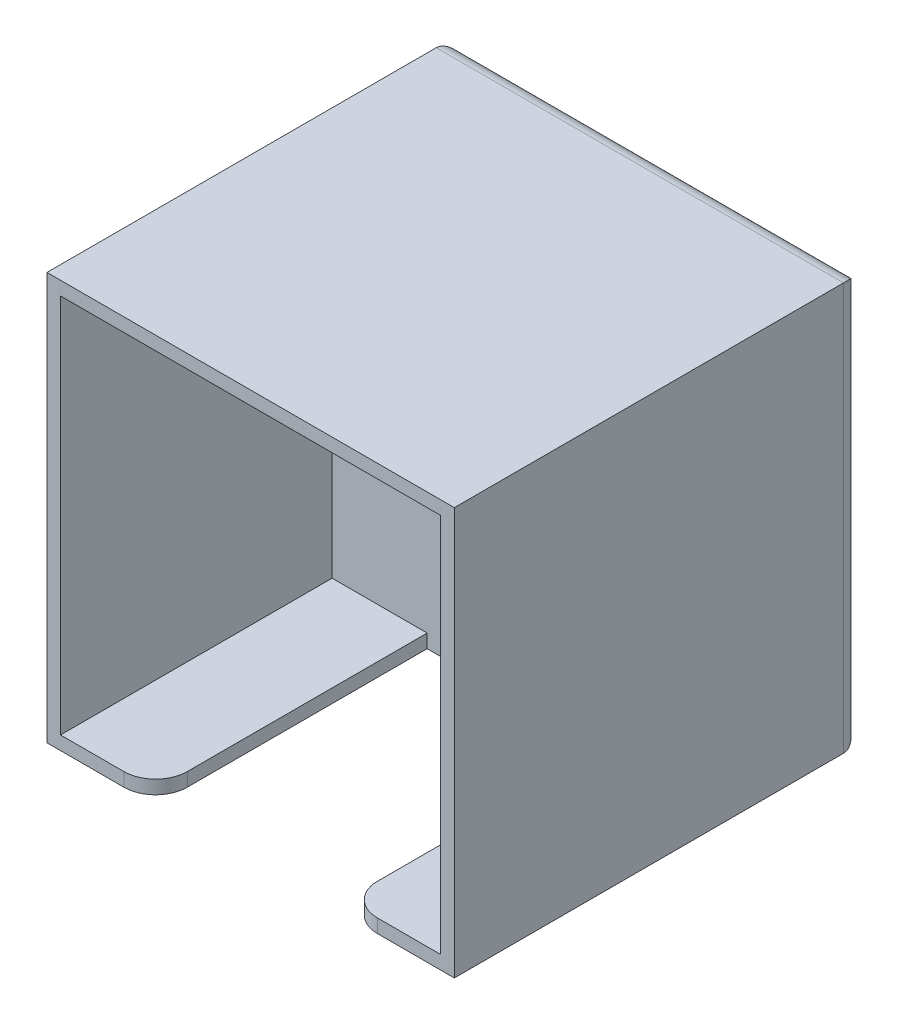
from build123d import *

# Parameters (mm, degrees)
SKETCH_2_W          = 45
SKETCH_2_H          = 45
EXTRUDE_1_DEPTH     = 45
SKETCH_3_W          = 42
SKETCH_3_H          = 42
CUT_EXTRUDE_1_DEPTH = 30
CUT_EXTRUDE_2_REACH = 69.5
SKETCH_4_W          = 21
SKETCH_4_H          = 30
FILLET_2_R          = 3.5
FILLET_3_R          = 2


with BuildPart() as part:
    # 草图2 → 凸台-拉伸1 (new body)
    with BuildSketch(Plane.XY):
        Rectangle(SKETCH_2_W, SKETCH_2_H)
    extrude(amount=EXTRUDE_1_DEPTH)

    # 草图3 → 切除-拉伸1 (cut)
    with BuildSketch(Plane.XY.offset(45)):
        Rectangle(SKETCH_3_W, SKETCH_3_H)
    extrude(amount=-CUT_EXTRUDE_1_DEPTH, mode=Mode.SUBTRACT)

    # 草图4 → 切除-拉伸2 (cut, up to next)
    with BuildSketch(Plane.XZ.offset(22.5), mode=Mode.PRIVATE) as cut_extrude_2_sk1:
        with Locations((0, 30)):
            Rectangle(SKETCH_4_W, SKETCH_4_H)
    cut_extrude_2_tool1 = extrude(cut_extrude_2_sk1.sketch, amount=-CUT_EXTRUDE_2_REACH, mode=Mode.PRIVATE) & part.part
    add(cut_extrude_2_tool1.solids().sort_by_distance((0, -22.5, 30))[0], mode=Mode.SUBTRACT)

    # 圆角2
    fillet_2_edges = [part.edges().sort_by_distance(p)[0] for p in [
        (10.5, -21.75, 45),
        (-10.5, -21.75, 45),
    ]]
    fillet(fillet_2_edges, radius=FILLET_2_R)

    # 圆角3
    fillet_3_edges = [part.edges().sort_by_distance(p)[0] for p in [
        (0, -22.5, 0),
        (-22.5, 0, 0),
        (0, 22.5, 0),
        (22.5, 0, 0),
    ]]
    fillet(fillet_3_edges, radius=FILLET_3_R)


solid = part.part
